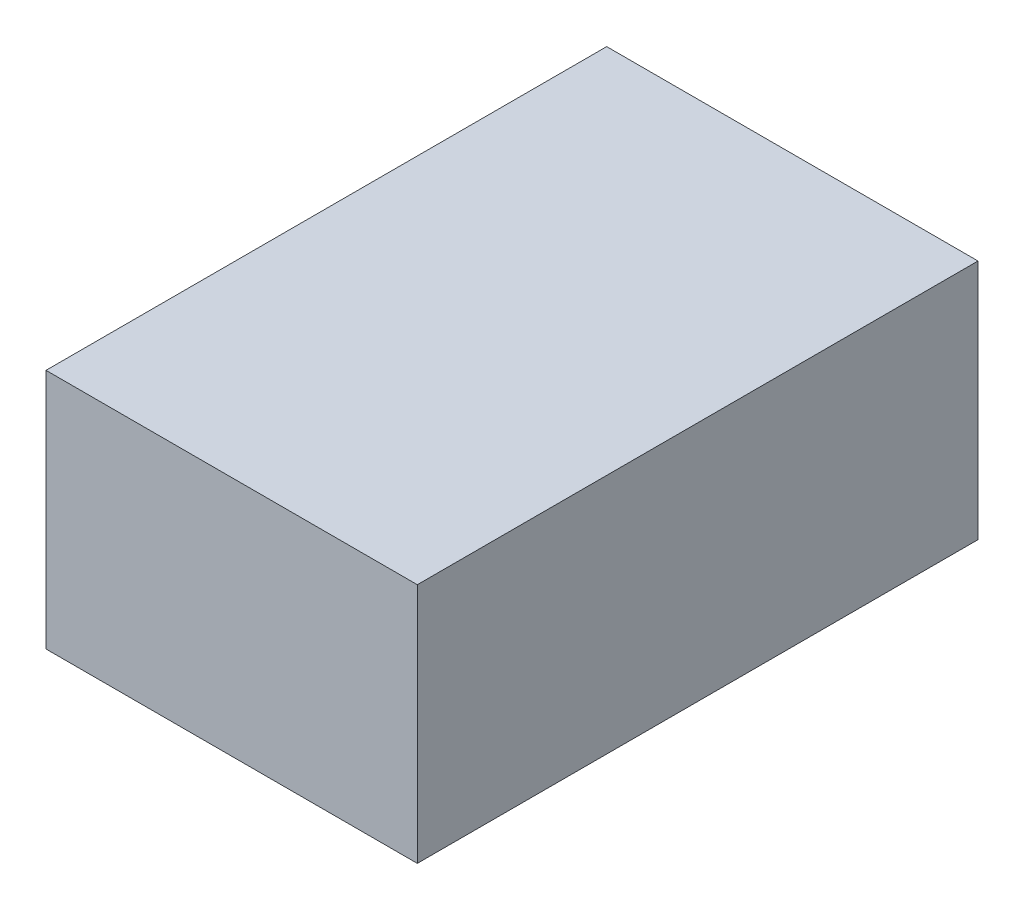
from build123d import *

# Parameters (mm, degrees)
SKETCH1_W           = 100
SKETCH1_H           = 65
BOSS_EXTRUDE1_DEPTH = 151


with BuildPart() as part:
    # Sketch1 → Boss-Extrude1 (new body)
    with BuildSketch(Plane.XY):
        Rectangle(SKETCH1_W, SKETCH1_H)
    extrude(amount=BOSS_EXTRUDE1_DEPTH)


solid = part.part
